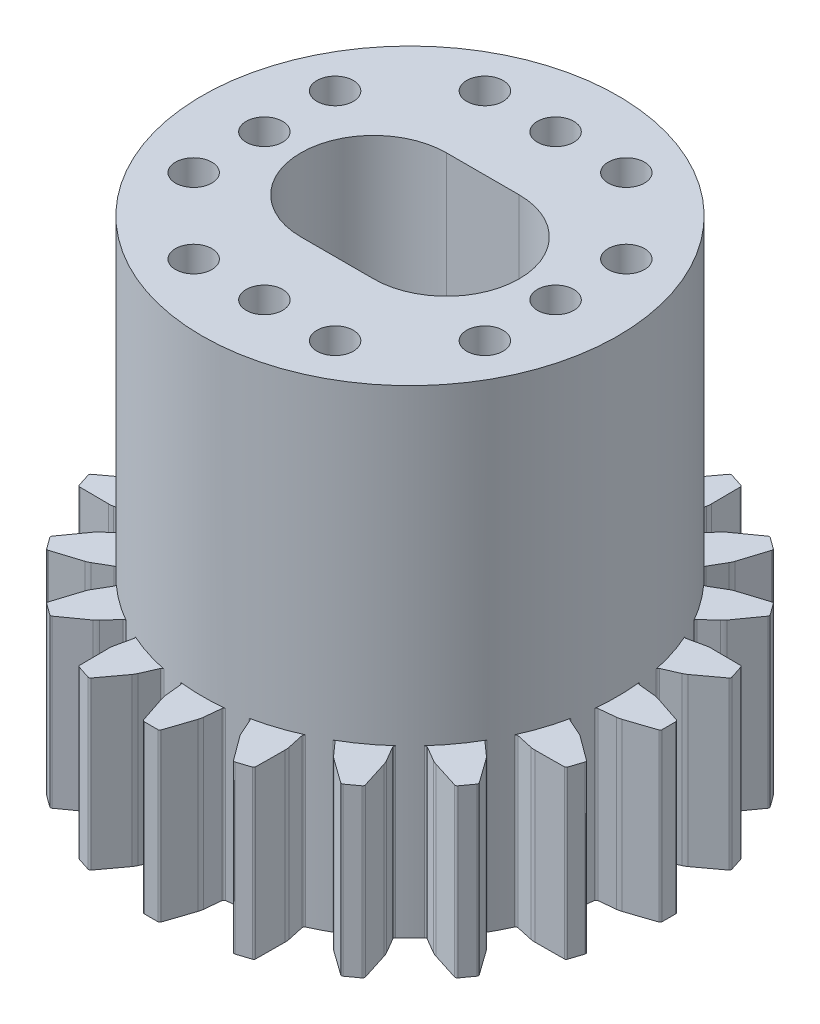
from build123d import *

# Parameters (mm, degrees)
BOSS_EXTRUDE1_DEPTH     = 8
SKETCH2_R               = 8
SKETCH2_R_2             = 5.5
CUT_EXTRUDE1_DEPTH      = 2.9
SKETCH3_R               = 10
BOSS_EXTRUDE2_DEPTH     = 15
SKETCH4_R               = 0.875
CUT_EXTRUDE2_DEPTH      = 15
CUT_EXTRUDE5_DEPTH      = 29.96547503
CUT_EXTRUDE5_DEPTH_BACK = 30


with BuildPart() as part:
    # Sketch1 → Boss-Extrude1 (new body)
    with BuildSketch(Plane(origin=(0, 0, 0), x_dir=(1, 0, 0), z_dir=(0, 1, 0))):
        with BuildLine():
            Line((-0.991896595, 10.030908424), (-0.911094624, 10.838928127))
            ThreePointArc((-0.911094624, 10.838928127), (-0.893940179, 10.94857827), (-0.864740732, 11.055652174))
            Line((-0.864740732, 11.055652174), (-0.422792408, 12.381497148))
            ThreePointArc((-0.422792408, 12.381497148), (-0.386395106, 12.43099859), (-0.327924078, 12.449874371))
            Line((-0.327924078, 12.449874371), (0.327924078, 12.449874371))
            ThreePointArc((0.327924078, 12.449874371), (0.386395106, 12.43099859), (0.422792408, 12.381497148))
            Line((0.422792408, 12.381497148), (0.864740732, 11.055652174))
            ThreePointArc((0.864740732, 11.055652174), (0.893940179, 10.94857827), (0.911094624, 10.838928127))
            Line((0.911094624, 10.838928127), (0.991896595, 10.030908424))
            ThreePointArc((0.991896595, 10.030908424), (1.020386157, 9.970452904), (1.08059437, 9.941444352))
            ThreePointArc((1.08059437, 9.941444352), (1.56434465, 9.876883406), (2.044368936, 9.788797457))
            ThreePointArc((2.044368936, 9.788797457), (2.110594485, 9.797780868), (2.156371452, 9.846473725))
            Line((2.156371452, 9.846473725), (2.482910513, 10.589976948))
            ThreePointArc((2.482910513, 10.589976948), (2.533109117, 10.688959415), (2.593967098, 10.781769624))
            Line((2.593967098, 10.781769624), (3.42399356, 11.906153583))
            ThreePointArc((3.42399356, 11.906153583), (3.473906237, 11.941984867), (3.535348427, 11.941868261))
            Line((3.535348427, 11.941868261), (4.15909709, 11.739200035))
            ThreePointArc((4.15909709, 11.739200035), (4.208873405, 11.703179558), (4.228192509, 11.644853505))
            Line((4.228192509, 11.644853505), (4.238801714, 10.24733046))
            ThreePointArc((4.238801714, 10.24733046), (4.233484382, 10.136474001), (4.215915472, 10.026889503))
            Line((4.215915472, 10.026889503), (4.043070892, 9.233447916))
            ThreePointArc((4.043070892, 9.233447916), (4.051484293, 9.167147542), (4.099781571, 9.120953408))
            ThreePointArc((4.099781571, 9.120953408), (4.539904997, 8.910065242), (4.969215167, 8.677954864))
            ThreePointArc((4.969215167, 8.677954864), (5.034975434, 8.666033776), (5.093558837, 8.698197574))
            Line((5.093558837, 8.698197574), (5.633871069, 9.30440504))
            ThreePointArc((5.633871069, 9.30440504), (5.712200044, 9.383030738), (5.798759355, 9.452492342))
            Line((5.798759355, 9.452492342), (6.935615182, 10.26535275))
            ThreePointArc((6.935615182, 10.26535275), (6.994157435, 10.284006461), (7.052556396, 10.264908881))
            Line((7.052556396, 10.264908881), (7.5831487, 9.879411007))
            ThreePointArc((7.5831487, 9.879411007), (7.61935785, 9.829771771), (7.619707668, 9.768330466))
            Line((7.619707668, 9.768330466), (7.197939251, 8.435928644))
            ThreePointArc((7.197939251, 8.435928644), (7.158625637, 8.332141031), (7.108053139, 8.233349072))
            Line((7.108053139, 8.233349072), (6.69848124, 7.532153194))
            ThreePointArc((6.69848124, 7.532153194), (6.685994918, 7.466497906), (6.717653586, 7.407639995))
            ThreePointArc((6.717653586, 7.407639995), (7.071067812, 7.071067812), (7.407639995, 6.717653586))
            ThreePointArc((7.407639995, 6.717653586), (7.466497906, 6.685994918), (7.532153194, 6.69848124))
            Line((7.532153194, 6.69848124), (8.233349072, 7.108053139))
            ThreePointArc((8.233349072, 7.108053139), (8.332141031, 7.158625637), (8.435928644, 7.197939251))
            Line((8.435928644, 7.197939251), (9.768330466, 7.619707668))
            ThreePointArc((9.768330466, 7.619707668), (9.829771771, 7.61935785), (9.879411007, 7.5831487))
            Line((9.879411007, 7.5831487), (10.264908881, 7.052556396))
            ThreePointArc((10.264908881, 7.052556396), (10.284006461, 6.994157435), (10.26535275, 6.935615182))
            Line((10.26535275, 6.935615182), (9.452492342, 5.798759355))
            ThreePointArc((9.452492342, 5.798759355), (9.383030738, 5.712200044), (9.30440504, 5.633871069))
            Line((9.30440504, 5.633871069), (8.698197574, 5.093558837))
            ThreePointArc((8.698197574, 5.093558837), (8.666033776, 5.034975434), (8.677954864, 4.969215167))
            ThreePointArc((8.677954864, 4.969215167), (8.910065242, 4.539904997), (9.120953408, 4.099781571))
            ThreePointArc((9.120953408, 4.099781571), (9.167147542, 4.051484293), (9.233447916, 4.043070892))
            Line((9.233447916, 4.043070892), (10.026889503, 4.215915472))
            ThreePointArc((10.026889503, 4.215915472), (10.136474001, 4.233484382), (10.24733046, 4.238801714))
            Line((10.24733046, 4.238801714), (11.644853505, 4.228192509))
            ThreePointArc((11.644853505, 4.228192509), (11.703179558, 4.208873405), (11.739200035, 4.15909709))
            Line((11.739200035, 4.15909709), (11.941868261, 3.535348427))
            ThreePointArc((11.941868261, 3.535348427), (11.941984867, 3.473906237), (11.906153583, 3.42399356))
            Line((11.906153583, 3.42399356), (10.781769624, 2.593967098))
            ThreePointArc((10.781769624, 2.593967098), (10.688959415, 2.533109117), (10.589976948, 2.482910513))
            Line((10.589976948, 2.482910513), (9.846473725, 2.156371452))
            ThreePointArc((9.846473725, 2.156371452), (9.797780868, 2.110594485), (9.788797457, 2.044368936))
            ThreePointArc((9.788797457, 2.044368936), (9.876883406, 1.56434465), (9.941444352, 1.08059437))
            ThreePointArc((9.941444352, 1.08059437), (9.970452904, 1.020386157), (10.030908424, 0.991896595))
            Line((10.030908424, 0.991896595), (10.838928127, 0.911094624))
            ThreePointArc((10.838928127, 0.911094624), (10.94857827, 0.893940179), (11.055652174, 0.864740732))
            Line((11.055652174, 0.864740732), (12.381497148, 0.422792408))
            ThreePointArc((12.381497148, 0.422792408), (12.43099859, 0.386395106), (12.449874371, 0.327924078))
            Line((12.449874371, 0.327924078), (12.449874371, -0.327924078))
            ThreePointArc((12.449874371, -0.327924078), (12.43099859, -0.386395106), (12.381497148, -0.422792408))
            Line((12.381497148, -0.422792408), (11.055652174, -0.864740732))
            ThreePointArc((11.055652174, -0.864740732), (10.94857827, -0.893940179), (10.838928127, -0.911094624))
            Line((10.838928127, -0.911094624), (10.030908424, -0.991896595))
            ThreePointArc((10.030908424, -0.991896595), (9.970452904, -1.020386157), (9.941444352, -1.08059437))
            ThreePointArc((9.941444352, -1.08059437), (9.876883406, -1.56434465), (9.788797457, -2.044368936))
            ThreePointArc((9.788797457, -2.044368936), (9.797780868, -2.110594485), (9.846473725, -2.156371452))
            Line((9.846473725, -2.156371452), (10.589976948, -2.482910513))
            ThreePointArc((10.589976948, -2.482910513), (10.688959415, -2.533109117), (10.781769624, -2.593967098))
            Line((10.781769624, -2.593967098), (11.906153583, -3.42399356))
            ThreePointArc((11.906153583, -3.42399356), (11.941984867, -3.473906237), (11.941868261, -3.535348427))
            Line((11.941868261, -3.535348427), (11.739200035, -4.15909709))
            ThreePointArc((11.739200035, -4.15909709), (11.703179558, -4.208873405), (11.644853505, -4.228192509))
            Line((11.644853505, -4.228192509), (10.24733046, -4.238801714))
            ThreePointArc((10.24733046, -4.238801714), (10.136474001, -4.233484382), (10.026889503, -4.215915472))
            Line((10.026889503, -4.215915472), (9.233447916, -4.043070892))
            ThreePointArc((9.233447916, -4.043070892), (9.167147542, -4.051484293), (9.120953408, -4.099781571))
            ThreePointArc((9.120953408, -4.099781571), (8.910065242, -4.539904997), (8.677954864, -4.969215167))
            ThreePointArc((8.677954864, -4.969215167), (8.666033776, -5.034975434), (8.698197574, -5.093558837))
            Line((8.698197574, -5.093558837), (9.30440504, -5.633871069))
            ThreePointArc((9.30440504, -5.633871069), (9.383030738, -5.712200044), (9.452492342, -5.798759355))
            Line((9.452492342, -5.798759355), (10.26535275, -6.935615182))
            ThreePointArc((10.26535275, -6.935615182), (10.284006461, -6.994157435), (10.264908881, -7.052556396))
            Line((10.264908881, -7.052556396), (9.879411007, -7.5831487))
            ThreePointArc((9.879411007, -7.5831487), (9.829771771, -7.61935785), (9.768330466, -7.619707668))
            Line((9.768330466, -7.619707668), (8.435928644, -7.197939251))
            ThreePointArc((8.435928644, -7.197939251), (8.332141031, -7.158625637), (8.233349072, -7.108053139))
            Line((8.233349072, -7.108053139), (7.532153194, -6.69848124))
            ThreePointArc((7.532153194, -6.69848124), (7.466497906, -6.685994918), (7.407639995, -6.717653586))
            ThreePointArc((7.407639995, -6.717653586), (7.071067812, -7.071067812), (6.717653586, -7.407639995))
            ThreePointArc((6.717653586, -7.407639995), (6.685994918, -7.466497906), (6.69848124, -7.532153194))
            Line((6.69848124, -7.532153194), (7.108053139, -8.233349072))
            ThreePointArc((7.108053139, -8.233349072), (7.158625637, -8.332141031), (7.197939251, -8.435928644))
            Line((7.197939251, -8.435928644), (7.619707668, -9.768330466))
            ThreePointArc((7.619707668, -9.768330466), (7.61935785, -9.829771771), (7.5831487, -9.879411007))
            Line((7.5831487, -9.879411007), (7.052556396, -10.264908881))
            ThreePointArc((7.052556396, -10.264908881), (6.994157435, -10.284006461), (6.935615182, -10.26535275))
            Line((6.935615182, -10.26535275), (5.798759355, -9.452492342))
            ThreePointArc((5.798759355, -9.452492342), (5.712200044, -9.383030738), (5.633871069, -9.30440504))
            Line((5.633871069, -9.30440504), (5.093558837, -8.698197574))
            ThreePointArc((5.093558837, -8.698197574), (5.034975434, -8.666033776), (4.969215167, -8.677954864))
            ThreePointArc((4.969215167, -8.677954864), (4.539904997, -8.910065242), (4.099781571, -9.120953408))
            ThreePointArc((4.099781571, -9.120953408), (4.051484293, -9.167147542), (4.043070892, -9.233447916))
            Line((4.043070892, -9.233447916), (4.215915472, -10.026889503))
            ThreePointArc((4.215915472, -10.026889503), (4.233484382, -10.136474001), (4.238801714, -10.24733046))
            Line((4.238801714, -10.24733046), (4.228192509, -11.644853505))
            ThreePointArc((4.228192509, -11.644853505), (4.208873405, -11.703179558), (4.15909709, -11.739200035))
            Line((4.15909709, -11.739200035), (3.535348427, -11.941868261))
            ThreePointArc((3.535348427, -11.941868261), (3.473906237, -11.941984867), (3.42399356, -11.906153583))
            Line((3.42399356, -11.906153583), (2.593967098, -10.781769624))
            ThreePointArc((2.593967098, -10.781769624), (2.533109117, -10.688959415), (2.482910513, -10.589976948))
            Line((2.482910513, -10.589976948), (2.156371452, -9.846473725))
            ThreePointArc((2.156371452, -9.846473725), (2.110594485, -9.797780868), (2.044368936, -9.788797457))
            ThreePointArc((2.044368936, -9.788797457), (1.56434465, -9.876883406), (1.08059437, -9.941444352))
            ThreePointArc((1.08059437, -9.941444352), (1.020386157, -9.970452904), (0.991896595, -10.030908424))
            Line((0.991896595, -10.030908424), (0.911094624, -10.838928127))
            ThreePointArc((0.911094624, -10.838928127), (0.893940179, -10.94857827), (0.864740732, -11.055652174))
            Line((0.864740732, -11.055652174), (0.422792408, -12.381497148))
            ThreePointArc((0.422792408, -12.381497148), (0.386395106, -12.43099859), (0.327924078, -12.449874371))
            Line((0.327924078, -12.449874371), (-0.327924078, -12.449874371))
            ThreePointArc((-0.327924078, -12.449874371), (-0.386395106, -12.43099859), (-0.422792408, -12.381497148))
            Line((-0.422792408, -12.381497148), (-0.864740732, -11.055652174))
            ThreePointArc((-0.864740732, -11.055652174), (-0.893940179, -10.94857827), (-0.911094624, -10.838928127))
            Line((-0.911094624, -10.838928127), (-0.991896595, -10.030908424))
            ThreePointArc((-0.991896595, -10.030908424), (-1.020386157, -9.970452904), (-1.08059437, -9.941444352))
            ThreePointArc((-1.08059437, -9.941444352), (-1.56434465, -9.876883406), (-2.044368936, -9.788797457))
            ThreePointArc((-2.044368936, -9.788797457), (-2.110594485, -9.797780868), (-2.156371452, -9.846473725))
            Line((-2.156371452, -9.846473725), (-2.482910513, -10.589976948))
            ThreePointArc((-2.482910513, -10.589976948), (-2.533109117, -10.688959415), (-2.593967098, -10.781769624))
            Line((-2.593967098, -10.781769624), (-3.42399356, -11.906153583))
            ThreePointArc((-3.42399356, -11.906153583), (-3.473906237, -11.941984867), (-3.535348427, -11.941868261))
            Line((-3.535348427, -11.941868261), (-4.15909709, -11.739200035))
            ThreePointArc((-4.15909709, -11.739200035), (-4.208873405, -11.703179558), (-4.228192509, -11.644853505))
            Line((-4.228192509, -11.644853505), (-4.238801714, -10.24733046))
            ThreePointArc((-4.238801714, -10.24733046), (-4.233484382, -10.136474001), (-4.215915472, -10.026889503))
            Line((-4.215915472, -10.026889503), (-4.043070892, -9.233447916))
            ThreePointArc((-4.043070892, -9.233447916), (-4.051484293, -9.167147542), (-4.099781571, -9.120953408))
            ThreePointArc((-4.099781571, -9.120953408), (-4.539904997, -8.910065242), (-4.969215167, -8.677954864))
            ThreePointArc((-4.969215167, -8.677954864), (-5.034975434, -8.666033776), (-5.093558837, -8.698197574))
            Line((-5.093558837, -8.698197574), (-5.633871069, -9.30440504))
            ThreePointArc((-5.633871069, -9.30440504), (-5.712200044, -9.383030738), (-5.798759355, -9.452492342))
            Line((-5.798759355, -9.452492342), (-6.935615182, -10.26535275))
            ThreePointArc((-6.935615182, -10.26535275), (-6.994157435, -10.284006461), (-7.052556396, -10.264908881))
            Line((-7.052556396, -10.264908881), (-7.5831487, -9.879411007))
            ThreePointArc((-7.5831487, -9.879411007), (-7.61935785, -9.829771771), (-7.619707668, -9.768330466))
            Line((-7.619707668, -9.768330466), (-7.197939251, -8.435928644))
            ThreePointArc((-7.197939251, -8.435928644), (-7.158625637, -8.332141031), (-7.108053139, -8.233349072))
            Line((-7.108053139, -8.233349072), (-6.69848124, -7.532153194))
            ThreePointArc((-6.69848124, -7.532153194), (-6.685994918, -7.466497906), (-6.717653586, -7.407639995))
            ThreePointArc((-6.717653586, -7.407639995), (-7.071067812, -7.071067812), (-7.407639995, -6.717653586))
            ThreePointArc((-7.407639995, -6.717653586), (-7.466497906, -6.685994918), (-7.532153194, -6.69848124))
            Line((-7.532153194, -6.69848124), (-8.233349072, -7.108053139))
            ThreePointArc((-8.233349072, -7.108053139), (-8.332141031, -7.158625637), (-8.435928644, -7.197939251))
            Line((-8.435928644, -7.197939251), (-9.768330466, -7.619707668))
            ThreePointArc((-9.768330466, -7.619707668), (-9.829771771, -7.61935785), (-9.879411007, -7.5831487))
            Line((-9.879411007, -7.5831487), (-10.264908881, -7.052556396))
            ThreePointArc((-10.264908881, -7.052556396), (-10.284006461, -6.994157435), (-10.26535275, -6.935615182))
            Line((-10.26535275, -6.935615182), (-9.452492342, -5.798759355))
            ThreePointArc((-9.452492342, -5.798759355), (-9.383030738, -5.712200044), (-9.30440504, -5.633871069))
            Line((-9.30440504, -5.633871069), (-8.698197574, -5.093558837))
            ThreePointArc((-8.698197574, -5.093558837), (-8.666033776, -5.034975434), (-8.677954864, -4.969215167))
            ThreePointArc((-8.677954864, -4.969215167), (-8.910065242, -4.539904997), (-9.120953408, -4.099781571))
            ThreePointArc((-9.120953408, -4.099781571), (-9.167147542, -4.051484293), (-9.233447916, -4.043070892))
            Line((-9.233447916, -4.043070892), (-10.026889503, -4.215915472))
            ThreePointArc((-10.026889503, -4.215915472), (-10.136474001, -4.233484382), (-10.24733046, -4.238801714))
            Line((-10.24733046, -4.238801714), (-11.644853505, -4.228192509))
            ThreePointArc((-11.644853505, -4.228192509), (-11.703179558, -4.208873405), (-11.739200035, -4.15909709))
            Line((-11.739200035, -4.15909709), (-11.941868261, -3.535348427))
            ThreePointArc((-11.941868261, -3.535348427), (-11.941984867, -3.473906237), (-11.906153583, -3.42399356))
            Line((-11.906153583, -3.42399356), (-10.781769624, -2.593967098))
            ThreePointArc((-10.781769624, -2.593967098), (-10.688959415, -2.533109117), (-10.589976948, -2.482910513))
            Line((-10.589976948, -2.482910513), (-9.846473725, -2.156371452))
            ThreePointArc((-9.846473725, -2.156371452), (-9.797780868, -2.110594485), (-9.788797457, -2.044368936))
            ThreePointArc((-9.788797457, -2.044368936), (-9.876883406, -1.56434465), (-9.941444352, -1.08059437))
            ThreePointArc((-9.941444352, -1.08059437), (-9.970452904, -1.020386157), (-10.030908424, -0.991896595))
            Line((-10.030908424, -0.991896595), (-10.838928127, -0.911094624))
            ThreePointArc((-10.838928127, -0.911094624), (-10.94857827, -0.893940179), (-11.055652174, -0.864740732))
            Line((-11.055652174, -0.864740732), (-12.381497148, -0.422792408))
            ThreePointArc((-12.381497148, -0.422792408), (-12.43099859, -0.386395106), (-12.449874371, -0.327924078))
            Line((-12.449874371, -0.327924078), (-12.449874371, 0.327924078))
            ThreePointArc((-12.449874371, 0.327924078), (-12.43099859, 0.386395106), (-12.381497148, 0.422792408))
            Line((-12.381497148, 0.422792408), (-11.055652174, 0.864740732))
            ThreePointArc((-11.055652174, 0.864740732), (-10.94857827, 0.893940179), (-10.838928127, 0.911094624))
            Line((-10.838928127, 0.911094624), (-10.030908424, 0.991896595))
            ThreePointArc((-10.030908424, 0.991896595), (-9.970452904, 1.020386157), (-9.941444352, 1.08059437))
            ThreePointArc((-9.941444352, 1.08059437), (-9.876883406, 1.56434465), (-9.788797457, 2.044368936))
            ThreePointArc((-9.788797457, 2.044368936), (-9.797780868, 2.110594485), (-9.846473725, 2.156371452))
            Line((-9.846473725, 2.156371452), (-10.589976948, 2.482910513))
            ThreePointArc((-10.589976948, 2.482910513), (-10.688959415, 2.533109117), (-10.781769624, 2.593967098))
            Line((-10.781769624, 2.593967098), (-11.906153583, 3.42399356))
            ThreePointArc((-11.906153583, 3.42399356), (-11.941984867, 3.473906237), (-11.941868261, 3.535348427))
            Line((-11.941868261, 3.535348427), (-11.739200035, 4.15909709))
            ThreePointArc((-11.739200035, 4.15909709), (-11.703179558, 4.208873405), (-11.644853505, 4.228192509))
            Line((-11.644853505, 4.228192509), (-10.24733046, 4.238801714))
            ThreePointArc((-10.24733046, 4.238801714), (-10.136474001, 4.233484382), (-10.026889503, 4.215915472))
            Line((-10.026889503, 4.215915472), (-9.233447916, 4.043070892))
            ThreePointArc((-9.233447916, 4.043070892), (-9.167147542, 4.051484293), (-9.120953408, 4.099781571))
            ThreePointArc((-9.120953408, 4.099781571), (-8.910065242, 4.539904997), (-8.677954864, 4.969215167))
            ThreePointArc((-8.677954864, 4.969215167), (-8.666033776, 5.034975434), (-8.698197574, 5.093558837))
            Line((-8.698197574, 5.093558837), (-9.30440504, 5.633871069))
            ThreePointArc((-9.30440504, 5.633871069), (-9.383030738, 5.712200044), (-9.452492342, 5.798759355))
            Line((-9.452492342, 5.798759355), (-10.26535275, 6.935615182))
            ThreePointArc((-10.26535275, 6.935615182), (-10.284006461, 6.994157435), (-10.264908881, 7.052556396))
            Line((-10.264908881, 7.052556396), (-9.879411007, 7.5831487))
            ThreePointArc((-9.879411007, 7.5831487), (-9.829771771, 7.61935785), (-9.768330466, 7.619707668))
            Line((-9.768330466, 7.619707668), (-8.435928644, 7.197939251))
            ThreePointArc((-8.435928644, 7.197939251), (-8.332141031, 7.158625637), (-8.233349072, 7.108053139))
            Line((-8.233349072, 7.108053139), (-7.532153194, 6.69848124))
            ThreePointArc((-7.532153194, 6.69848124), (-7.466497906, 6.685994918), (-7.407639995, 6.717653586))
            ThreePointArc((-7.407639995, 6.717653586), (-7.071067812, 7.071067812), (-6.717653586, 7.407639995))
            ThreePointArc((-6.717653586, 7.407639995), (-6.685994918, 7.466497906), (-6.69848124, 7.532153194))
            Line((-6.69848124, 7.532153194), (-7.108053139, 8.233349072))
            ThreePointArc((-7.108053139, 8.233349072), (-7.158625637, 8.332141031), (-7.197939251, 8.435928644))
            Line((-7.197939251, 8.435928644), (-7.619707668, 9.768330466))
            ThreePointArc((-7.619707668, 9.768330466), (-7.61935785, 9.829771771), (-7.5831487, 9.879411007))
            Line((-7.5831487, 9.879411007), (-7.052556396, 10.264908881))
            ThreePointArc((-7.052556396, 10.264908881), (-6.994157435, 10.284006461), (-6.935615182, 10.26535275))
            Line((-6.935615182, 10.26535275), (-5.798759355, 9.452492342))
            ThreePointArc((-5.798759355, 9.452492342), (-5.712200044, 9.383030738), (-5.633871069, 9.30440504))
            Line((-5.633871069, 9.30440504), (-5.093558837, 8.698197574))
            ThreePointArc((-5.093558837, 8.698197574), (-5.034975434, 8.666033776), (-4.969215167, 8.677954864))
            ThreePointArc((-4.969215167, 8.677954864), (-4.539904997, 8.910065242), (-4.099781571, 9.120953408))
            ThreePointArc((-4.099781571, 9.120953408), (-4.051484293, 9.167147542), (-4.043070892, 9.233447916))
            Line((-4.043070892, 9.233447916), (-4.215915472, 10.026889503))
            ThreePointArc((-4.215915472, 10.026889503), (-4.233484382, 10.136474001), (-4.238801714, 10.24733046))
            Line((-4.238801714, 10.24733046), (-4.228192509, 11.644853505))
            ThreePointArc((-4.228192509, 11.644853505), (-4.208873405, 11.703179558), (-4.15909709, 11.739200035))
            Line((-4.15909709, 11.739200035), (-3.535348427, 11.941868261))
            ThreePointArc((-3.535348427, 11.941868261), (-3.473906237, 11.941984867), (-3.42399356, 11.906153583))
            Line((-3.42399356, 11.906153583), (-2.593967098, 10.781769624))
            ThreePointArc((-2.593967098, 10.781769624), (-2.533109117, 10.688959415), (-2.482910513, 10.589976948))
            Line((-2.482910513, 10.589976948), (-2.156371452, 9.846473725))
            ThreePointArc((-2.156371452, 9.846473725), (-2.110594485, 9.797780868), (-2.044368936, 9.788797457))
            ThreePointArc((-2.044368936, 9.788797457), (-1.56434465, 9.876883406), (-1.08059437, 9.941444352))
            ThreePointArc((-1.08059437, 9.941444352), (-1.020386157, 9.970452904), (-0.991896595, 10.030908424))
        make_face()
    extrude(amount=BOSS_EXTRUDE1_DEPTH)

    # Sketch2 → Cut-Extrude1 (cut)
    with BuildSketch(Plane.XZ):
        Circle(SKETCH2_R)
        Circle(SKETCH2_R_2, mode=Mode.SUBTRACT)
    extrude(amount=-CUT_EXTRUDE1_DEPTH, mode=Mode.SUBTRACT)

    # Sketch3 → Boss-Extrude2 (add)
    with BuildSketch(Plane(origin=(0, 8, 0), x_dir=(1, 0, 0), z_dir=(0, 1, 0))):
        Circle(SKETCH3_R)
    extrude(amount=BOSS_EXTRUDE2_DEPTH)

    # Sketch4 → Cut-Extrude2 (cut)
    with BuildSketch(Plane(origin=(0, 23, 0), x_dir=(1, 0, 0), z_dir=(0, 1, 0))):
        with Locations((0, 7)):
            Circle(SKETCH4_R)
        with Locations((3.4, 7)):
            Circle(SKETCH4_R)
        with Locations((-3.4, 7)):
            Circle(SKETCH4_R)
        with Locations((7, 3.4)):
            Circle(SKETCH4_R)
        with Locations((7, 0)):
            Circle(SKETCH4_R)
        with Locations((7, -3.4)):
            Circle(SKETCH4_R)
        with Locations((3.4, -7)):
            Circle(SKETCH4_R)
        with Locations((0, -7)):
            Circle(SKETCH4_R)
        with Locations((-3.4, -7)):
            Circle(SKETCH4_R)
        with Locations((-7, -3.4)):
            Circle(SKETCH4_R)
        with Locations((-7, 0)):
            Circle(SKETCH4_R)
        with Locations((-7, 3.4)):
            Circle(SKETCH4_R)
    extrude(amount=-CUT_EXTRUDE2_DEPTH, mode=Mode.SUBTRACT)

    # Sketch5 → Cut-Extrude5 (cut, two sides: drawn at the far end of the back side and taken through both)
    with BuildSketch(Plane.XZ.offset(-CUT_EXTRUDE5_DEPTH_BACK)):
        with BuildLine():
            Line((-1.75, 3.5), (1.75, 3.5))
            ThreePointArc((1.75, 3.5), (5.25, 0), (1.75, -3.5))
            Line((1.75, -3.5), (-1.75, -3.5))
            ThreePointArc((-1.75, -3.5), (-5.25, 0), (-1.75, 3.5))
        make_face()
    extrude(amount=CUT_EXTRUDE5_DEPTH + CUT_EXTRUDE5_DEPTH_BACK, mode=Mode.SUBTRACT)


solid = part.part
